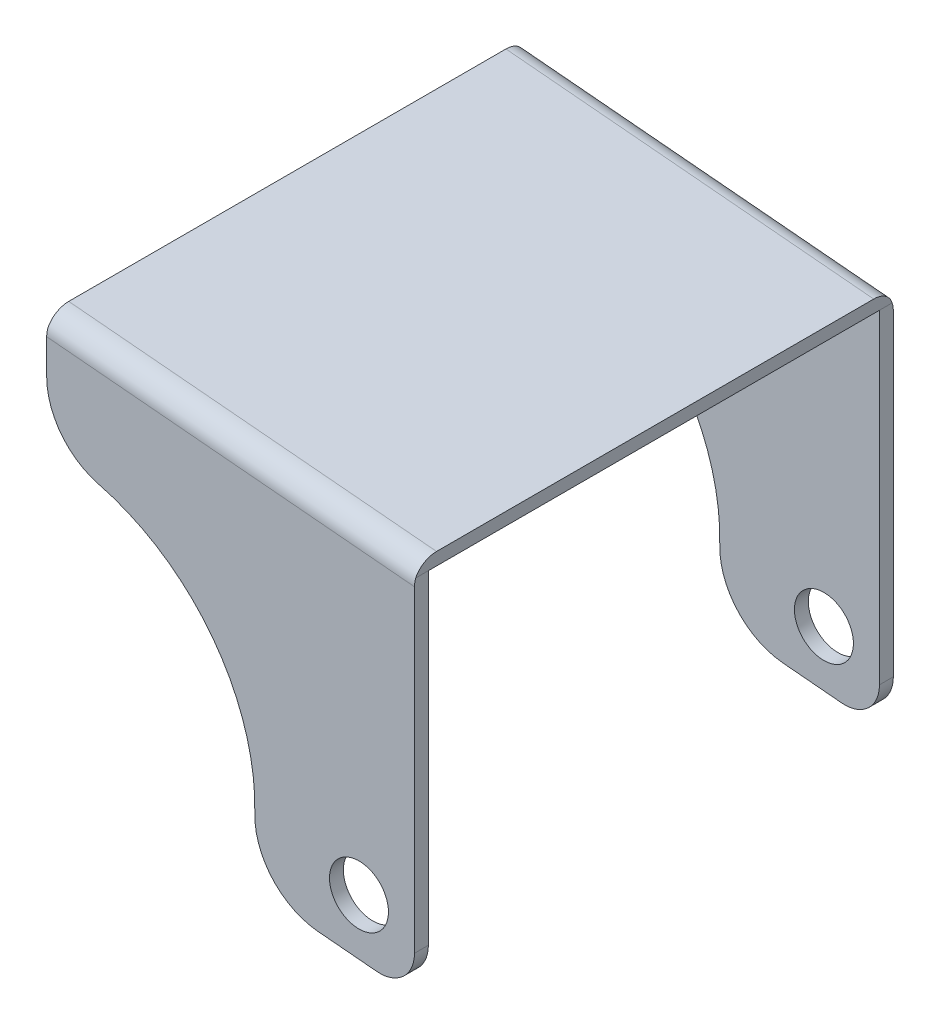
from build123d import *

# Parameters (mm, degrees)
BOSS_EXTRUDE1_DEPTH = 2
FILLET1_R           = 5
SKETCH2_R           = 4.25
CUT_EXTRUDE1_DEPTH  = 10
SKETCH3_W           = 53.20846293
SKETCH3_H           = 69
BOSS_EXTRUDE2_DEPTH = 2
FILLET2_R           = 3


with BuildPart() as part:
    # Sketch1 → Boss-Extrude1 (new body)
    with BuildSketch(Plane.XY):
        with BuildLine():
            Line((-27.5, 15.515231625), (-27.5, 21.501022606))
            Line((-27.5, 21.501022606), (25.5, 16.795650425))
            Line((25.5, 16.795650425), (25.5, -35.408879242))
            Line((25.5, -35.408879242), (11.603178078, -34.175110954))
            ThreePointArc((11.603178078, -34.175110954), (5.026609694, -30.872744893), (2.490629392, -23.964367571))
            ThreePointArc((2.490629392, -23.964367571), (-3.555183787, -5.141257472), (-20, 5.83277326))
            ThreePointArc((-20, 5.83277326), (-25.40569415, 9.391507269), (-27.5, 15.515231625))
        make_face()
    extrude(amount=BOSS_EXTRUDE1_DEPTH)

    # Fillet1
    fillet1_edges = [part.edges().sort_by_distance(p)[0] for p in [
        (25.5, -35.408879242, 1),
    ]]
    fillet(fillet1_edges, radius=FILLET1_R)

    # Sketch2 → Cut-Extrude1 (cut)
    with BuildSketch(Plane.XY.offset(2)):
        with Locations((17.5, -26.667168282)):
            Circle(SKETCH2_R)
    extrude(amount=-CUT_EXTRUDE1_DEPTH, mode=Mode.SUBTRACT)


with BuildPart() as body_2:
    # Mirror3: mirrored copy
    add(part.part.mirror(Plane(origin=(0, 0, -32.5), x_dir=(1, 0, 0), z_dir=(0, 0, -1))))


with BuildPart() as part_1:
    add(part.part)

    add(body_2.part)  # Boss-Extrude2 merges body 2
    # Sketch3 → Boss-Extrude2 (add)
    with BuildSketch(Plane(origin=(1.678885973, 18.910503392, 0), x_dir=(0.9960821471166026, -0.08843277783479815, 0), z_dir=(0.08843277783479815, 0.9960821471166027, 0))):
        with Locations((-2.689422736, 32.5)):
            Rectangle(SKETCH3_W, SKETCH3_H)
    extrude(amount=BOSS_EXTRUDE2_DEPTH)

    # Fillet2
    fillet2_edges = [part_1.edges().sort_by_distance(p)[0] for p in [
        (-0.823134444, 21.140500809, 2),
        (-0.823134444, 21.140500809, -67),
    ]]
    fillet(fillet2_edges, radius=FILLET2_R)


solid = part_1.part
